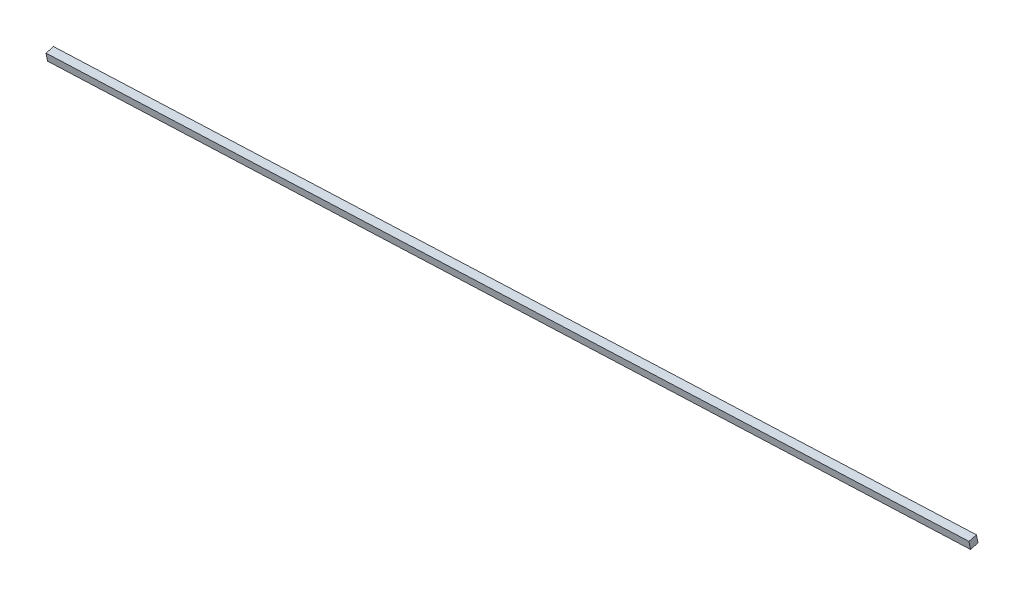
from build123d import *

# Parameters (mm, degrees)
BOSS_EXTRUDE1_DEPTH = 332.522844577


with BuildPart() as part:
    # Sketch3 → Boss-Extrude1 (new body)
    with BuildSketch(Plane(origin=(-39.436255758, 0, 1.721824111), x_dir=(0.0436193873653368, 0, 0.9990482215818578), z_dir=(-0.9990482215818578, 0, 0.0436193873653368))):
        Polygon((6.578046373, 24.805088746), (7.18976987, 27.742059016), (10.126740139, 27.130335519), (9.515016642, 24.193365249), align=None)
    extrude(amount=BOSS_EXTRUDE1_DEPTH)


solid = part.part
